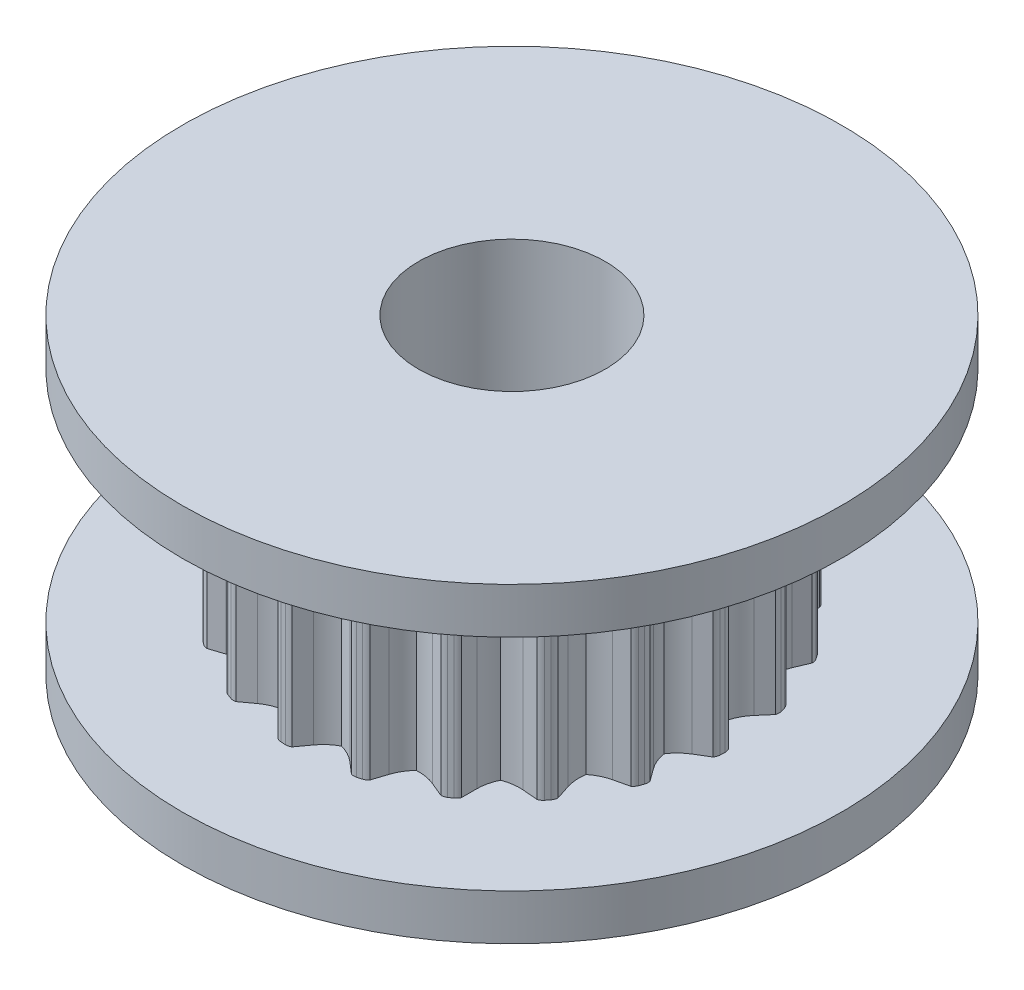
from build123d import *

# Parameters (mm, degrees)
EXTRUDE_1_DEPTH     = 3
SKETCH_3_R          = 9
EXTRUDE_2_DEPTH     = 1.25
SKETCH_4_R          = 2.55
CUT_EXTRUDE_1_DEPTH = 16.305227865


with BuildPart() as part:
    # 草图1 → 凸台-拉伸1 (new, symmetric)
    with BuildSketch(Plane(origin=(0, 0, 0), x_dir=(1, 0, 0), z_dir=(0, 1, 0))):
        with BuildLine():
            Line((-3.376752543, 4.959590937), (-3.267426565, 5.032288112))
            ThreePointArc((-3.267426565, 5.032288112), (-3.200992642, 5.061911558), (-3.128917634, 5.071720118))
            Line((-3.128917634, 5.071720118), (-2.741254989, 4.909115673))
            ThreePointArc((-2.741254989, 4.909115673), (-2.480001123, 4.833197231), (-2.208338066, 4.818487533))
            ThreePointArc((-2.208338066, 4.818487533), (-2.042130114, 5.033875807), (-1.929083368, 5.281338179))
            Line((-1.929083368, 5.281338179), (-1.799177632, 5.681146923))
            ThreePointArc((-1.799177632, 5.681146923), (-1.744694694, 5.729340533), (-1.678884625, 5.7603252))
            Line((-1.678884625, 5.7603252), (-1.552444779, 5.795680737))
            ThreePointArc((-1.552444779, 5.795680737), (-1.480108215, 5.803325098), (-1.408529797, 5.79038119))
            Line((-1.408529797, 5.79038119), (-1.09008825, 5.515940827))
            ThreePointArc((-1.09008825, 5.515940827), (-0.865081147, 5.363006214), (-0.611259773, 5.265067959))
            ThreePointArc((-0.611259773, 5.265067959), (-0.38662798, 5.418553299), (-0.202644057, 5.618970634))
            Line((-0.202644057, 5.618970634), (0.044451336, 5.959068265))
            ThreePointArc((0.044451336, 5.959068265), (0.111160334, 5.988066959), (0.183324217, 5.997198699))
            Line((0.183324217, 5.997198699), (0.314501119, 5.991751751))
            ThreePointArc((0.314501119, 5.991751751), (0.385659516, 5.976668742), (0.449734749, 5.942239407))
            Line((0.449734749, 5.942239407), (0.667783922, 5.582827262))
            ThreePointArc((0.667783922, 5.582827262), (0.834518999, 5.367846783), (1.045652886, 5.196266848))
            ThreePointArc((1.045652886, 5.196266848), (1.306719995, 5.27282504), (1.543631466, 5.406579094))
            Line((1.543631466, 5.406579094), (1.883729097, 5.653674487))
            ThreePointArc((1.883729097, 5.653674487), (1.956134214, 5.660639669), (2.027588008, 5.647024603))
            Line((2.027588008, 5.647024603), (2.150661455, 5.601308356))
            ThreePointArc((2.150661455, 5.601308356), (2.213676207, 5.564974409), (2.263976125, 5.512429829))
            Line((2.263976125, 5.512429829), (2.360288751, 5.103227666))
            ThreePointArc((2.360288751, 5.103227666), (2.452430611, 4.847245108), (2.600209754, 4.618818935))
            ThreePointArc((2.600209754, 4.618818935), (2.872157112, 4.610955928), (3.138805586, 4.664953922))
            Line((3.138805586, 4.664953922), (3.53861433, 4.794859658))
            ThreePointArc((3.53861433, 4.794859658), (3.609628047, 4.779109528), (3.673377357, 4.744080395))
            Line((3.673377357, 4.744080395), (3.776300064, 4.662569873))
            ThreePointArc((3.776300064, 4.662569873), (3.825002847, 4.608541606), (3.856603744, 4.543025212))
            Line((3.856603744, 4.543025212), (3.821752072, 4.12408859))
            ThreePointArc((3.821752072, 4.12408859), (3.830281228, 3.85216131), (3.900239975, 3.589248842))
            ThreePointArc((3.900239975, 3.589248842), (4.156447479, 3.497734324), (4.426731546, 3.466690558))
            Line((4.426731546, 3.466690558), (4.847115337, 3.466690558))
            ThreePointArc((4.847115337, 3.466690558), (4.909786338, 3.429766849), (4.959590937, 3.376752543))
            Line((4.959590937, 3.376752543), (5.032288112, 3.267426565))
            ThreePointArc((5.032288112, 3.267426565), (5.061911558, 3.200992642), (5.071720118, 3.128917634))
            Line((5.071720118, 3.128917634), (4.909115673, 2.741254989))
            ThreePointArc((4.909115673, 2.741254989), (4.833197231, 2.480001123), (4.818487533, 2.208338066))
            ThreePointArc((4.818487533, 2.208338066), (5.033875807, 2.042130114), (5.281338179, 1.929083368))
            Line((5.281338179, 1.929083368), (5.681146923, 1.799177632))
            ThreePointArc((5.681146923, 1.799177632), (5.729340533, 1.744694694), (5.7603252, 1.678884625))
            Line((5.7603252, 1.678884625), (5.795680737, 1.552444779))
            ThreePointArc((5.795680737, 1.552444779), (5.803325098, 1.480108215), (5.79038119, 1.408529797))
            Line((5.79038119, 1.408529797), (5.515940827, 1.09008825))
            ThreePointArc((5.515940827, 1.09008825), (5.363006214, 0.865081147), (5.265067959, 0.611259773))
            ThreePointArc((5.265067959, 0.611259773), (5.418553299, 0.38662798), (5.618970634, 0.202644057))
            Line((5.618970634, 0.202644057), (5.959068265, -0.044451336))
            ThreePointArc((5.959068265, -0.044451336), (5.988066959, -0.111160334), (5.997198699, -0.183324217))
            Line((5.997198699, -0.183324217), (5.991751751, -0.314501119))
            ThreePointArc((5.991751751, -0.314501119), (5.976668742, -0.385659516), (5.942239407, -0.449734749))
            Line((5.942239407, -0.449734749), (5.582827262, -0.667783922))
            ThreePointArc((5.582827262, -0.667783922), (5.367846783, -0.834518999), (5.196266848, -1.045652886))
            ThreePointArc((5.196266848, -1.045652886), (5.27282504, -1.306719995), (5.406579094, -1.543631466))
            Line((5.406579094, -1.543631466), (5.653674487, -1.883729097))
            ThreePointArc((5.653674487, -1.883729097), (5.660639669, -1.956134214), (5.647024603, -2.027588008))
            Line((5.647024603, -2.027588008), (5.601308356, -2.150661455))
            ThreePointArc((5.601308356, -2.150661455), (5.564974409, -2.213676207), (5.512429829, -2.263976125))
            Line((5.512429829, -2.263976125), (5.103227666, -2.360288751))
            ThreePointArc((5.103227666, -2.360288751), (4.847245108, -2.452430611), (4.618818935, -2.600209754))
            ThreePointArc((4.618818935, -2.600209754), (4.610955928, -2.872157112), (4.664953922, -3.138805586))
            Line((4.664953922, -3.138805586), (4.794859658, -3.53861433))
            ThreePointArc((4.794859658, -3.53861433), (4.779109528, -3.609628047), (4.744080395, -3.673377357))
            Line((4.744080395, -3.673377357), (4.662569873, -3.776300064))
            ThreePointArc((4.662569873, -3.776300064), (4.608541606, -3.825002847), (4.543025212, -3.856603744))
            Line((4.543025212, -3.856603744), (4.12408859, -3.821752072))
            ThreePointArc((4.12408859, -3.821752072), (3.85216131, -3.830281228), (3.589248842, -3.900239975))
            ThreePointArc((3.589248842, -3.900239975), (3.497734324, -4.156447479), (3.466690558, -4.426731546))
            Line((3.466690558, -4.426731546), (3.466690558, -4.847115337))
            ThreePointArc((3.466690558, -4.847115337), (3.429766849, -4.909786338), (3.376752543, -4.959590937))
            Line((3.376752543, -4.959590937), (3.267426565, -5.032288112))
            ThreePointArc((3.267426565, -5.032288112), (3.200992642, -5.061911558), (3.128917634, -5.071720118))
            Line((3.128917634, -5.071720118), (2.741254989, -4.909115673))
            ThreePointArc((2.741254989, -4.909115673), (2.480001123, -4.833197231), (2.208338066, -4.818487533))
            ThreePointArc((2.208338066, -4.818487533), (2.042130114, -5.033875807), (1.929083368, -5.281338179))
            Line((1.929083368, -5.281338179), (1.799177632, -5.681146923))
            ThreePointArc((1.799177632, -5.681146923), (1.744694694, -5.729340533), (1.678884625, -5.7603252))
            Line((1.678884625, -5.7603252), (1.552444779, -5.795680737))
            ThreePointArc((1.552444779, -5.795680737), (1.480108215, -5.803325098), (1.408529797, -5.79038119))
            Line((1.408529797, -5.79038119), (1.09008825, -5.515940827))
            ThreePointArc((1.09008825, -5.515940827), (0.865081147, -5.363006214), (0.611259773, -5.265067959))
            ThreePointArc((0.611259773, -5.265067959), (0.38662798, -5.418553299), (0.202644057, -5.618970634))
            Line((0.202644057, -5.618970634), (-0.044451336, -5.959068265))
            ThreePointArc((-0.044451336, -5.959068265), (-0.111160334, -5.988066959), (-0.183324217, -5.997198699))
            Line((-0.183324217, -5.997198699), (-0.314501119, -5.991751751))
            ThreePointArc((-0.314501119, -5.991751751), (-0.385659516, -5.976668742), (-0.449734749, -5.942239407))
            Line((-0.449734749, -5.942239407), (-0.667783922, -5.582827262))
            ThreePointArc((-0.667783922, -5.582827262), (-0.834518999, -5.367846783), (-1.045652886, -5.196266848))
            ThreePointArc((-1.045652886, -5.196266848), (-1.306719995, -5.27282504), (-1.543631466, -5.406579094))
            Line((-1.543631466, -5.406579094), (-1.883729097, -5.653674487))
            ThreePointArc((-1.883729097, -5.653674487), (-1.956134214, -5.660639669), (-2.027588008, -5.647024603))
            Line((-2.027588008, -5.647024603), (-2.150661455, -5.601308356))
            ThreePointArc((-2.150661455, -5.601308356), (-2.213676207, -5.564974409), (-2.263976125, -5.512429829))
            Line((-2.263976125, -5.512429829), (-2.360288751, -5.103227666))
            ThreePointArc((-2.360288751, -5.103227666), (-2.452430611, -4.847245108), (-2.600209754, -4.618818935))
            ThreePointArc((-2.600209754, -4.618818935), (-2.872157112, -4.610955928), (-3.138805586, -4.664953922))
            Line((-3.138805586, -4.664953922), (-3.53861433, -4.794859658))
            ThreePointArc((-3.53861433, -4.794859658), (-3.609628047, -4.779109528), (-3.673377357, -4.744080395))
            Line((-3.673377357, -4.744080395), (-3.776300064, -4.662569873))
            ThreePointArc((-3.776300064, -4.662569873), (-3.825002847, -4.608541606), (-3.856603744, -4.543025212))
            Line((-3.856603744, -4.543025212), (-3.821752072, -4.12408859))
            ThreePointArc((-3.821752072, -4.12408859), (-3.830281228, -3.85216131), (-3.900239975, -3.589248842))
            ThreePointArc((-3.900239975, -3.589248842), (-4.156447479, -3.497734324), (-4.426731546, -3.466690558))
            Line((-4.426731546, -3.466690558), (-4.847115337, -3.466690558))
            ThreePointArc((-4.847115337, -3.466690558), (-4.909786338, -3.429766849), (-4.959590937, -3.376752543))
            Line((-4.959590937, -3.376752543), (-5.032288112, -3.267426565))
            ThreePointArc((-5.032288112, -3.267426565), (-5.061911558, -3.200992642), (-5.071720118, -3.128917634))
            Line((-5.071720118, -3.128917634), (-4.909115673, -2.741254989))
            ThreePointArc((-4.909115673, -2.741254989), (-4.833197231, -2.480001123), (-4.818487533, -2.208338066))
            ThreePointArc((-4.818487533, -2.208338066), (-5.033875807, -2.042130114), (-5.281338179, -1.929083368))
            Line((-5.281338179, -1.929083368), (-5.681146923, -1.799177632))
            ThreePointArc((-5.681146923, -1.799177632), (-5.729340533, -1.744694694), (-5.7603252, -1.678884625))
            Line((-5.7603252, -1.678884625), (-5.795680737, -1.552444779))
            ThreePointArc((-5.795680737, -1.552444779), (-5.803325098, -1.480108215), (-5.79038119, -1.408529797))
            Line((-5.79038119, -1.408529797), (-5.515940827, -1.09008825))
            ThreePointArc((-5.515940827, -1.09008825), (-5.363006214, -0.865081147), (-5.265067959, -0.611259773))
            ThreePointArc((-5.265067959, -0.611259773), (-5.418553299, -0.38662798), (-5.618970634, -0.202644057))
            Line((-5.618970634, -0.202644057), (-5.959068265, 0.044451336))
            ThreePointArc((-5.959068265, 0.044451336), (-5.988066959, 0.111160334), (-5.997198699, 0.183324217))
            Line((-5.997198699, 0.183324217), (-5.991751751, 0.314501119))
            ThreePointArc((-5.991751751, 0.314501119), (-5.976668742, 0.385659516), (-5.942239407, 0.449734749))
            Line((-5.942239407, 0.449734749), (-5.582827262, 0.667783922))
            ThreePointArc((-5.582827262, 0.667783922), (-5.367846783, 0.834518999), (-5.196266848, 1.045652886))
            ThreePointArc((-5.196266848, 1.045652886), (-5.27282504, 1.306719995), (-5.406579094, 1.543631466))
            Line((-5.406579094, 1.543631466), (-5.653674487, 1.883729097))
            ThreePointArc((-5.653674487, 1.883729097), (-5.660639669, 1.956134214), (-5.647024603, 2.027588008))
            Line((-5.647024603, 2.027588008), (-5.601308356, 2.150661455))
            ThreePointArc((-5.601308356, 2.150661455), (-5.564974409, 2.213676207), (-5.512429829, 2.263976125))
            Line((-5.512429829, 2.263976125), (-5.103227666, 2.360288751))
            ThreePointArc((-5.103227666, 2.360288751), (-4.847245108, 2.452430611), (-4.618818935, 2.600209754))
            ThreePointArc((-4.618818935, 2.600209754), (-4.610955928, 2.872157112), (-4.664953922, 3.138805586))
            Line((-4.664953922, 3.138805586), (-4.794859658, 3.53861433))
            ThreePointArc((-4.794859658, 3.53861433), (-4.779109528, 3.609628047), (-4.744080395, 3.673377357))
            Line((-4.744080395, 3.673377357), (-4.662569873, 3.776300064))
            ThreePointArc((-4.662569873, 3.776300064), (-4.608541606, 3.825002847), (-4.543025212, 3.856603744))
            Line((-4.543025212, 3.856603744), (-4.12408859, 3.821752072))
            ThreePointArc((-4.12408859, 3.821752072), (-3.85216131, 3.830281228), (-3.589248842, 3.900239975))
            ThreePointArc((-3.589248842, 3.900239975), (-3.497734324, 4.156447479), (-3.466690558, 4.426731546))
            Line((-3.466690558, 4.426731546), (-3.466690558, 4.847115337))
            ThreePointArc((-3.466690558, 4.847115337), (-3.429766849, 4.909786338), (-3.376752543, 4.959590937))
        make_face()
    extrude(amount=EXTRUDE_1_DEPTH, both=True)

    # 草图3 → 凸台-拉伸2 (add)
    with BuildSketch(Plane(origin=(0, 3, 0), x_dir=(1, 0, 0), z_dir=(0, 1, 0))):
        with Locations(Location((0, 0, 0), (0, 0, 270))):
            Circle(SKETCH_3_R)
    extrude_2 = extrude(amount=EXTRUDE_2_DEPTH)

    # 镜向1: 凸台-拉伸2 across plane
    add(extrude_2.mirror(Plane.ZX))

    # 草图4 → 切除-拉伸1 (cut, through all)
    with BuildSketch(Plane(origin=(0, 4.25, 0), x_dir=(1, 0, 0), z_dir=(0, 1, 0))):
        with Locations(Location((0, 0, 0), (0, 0, 270))):
            Circle(SKETCH_4_R)
    extrude(amount=-CUT_EXTRUDE_1_DEPTH, mode=Mode.SUBTRACT)


solid = part.part
